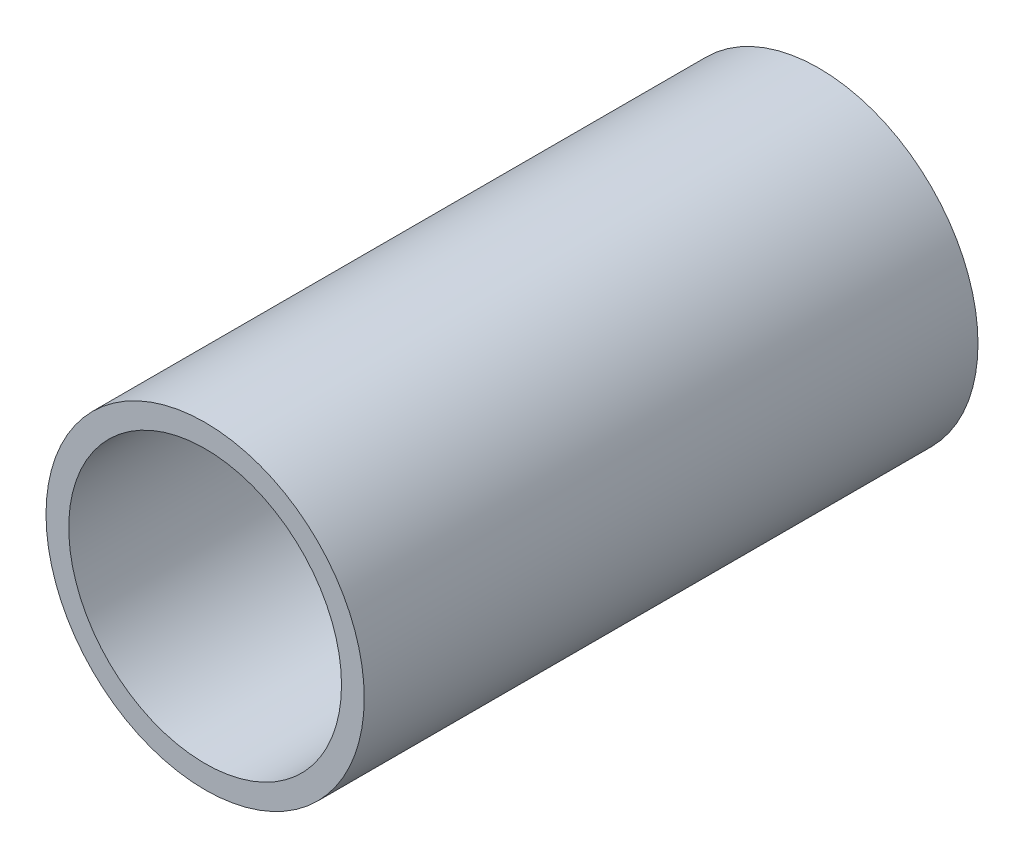
from build123d import *

# Parameters (mm, degrees)
SKETCH1_R           = 22.225
SKETCH1_R_2         = 19.05
BOSS_EXTRUDE1_DEPTH = 85.725


with BuildPart() as part:
    # Sketch1 → Boss-Extrude1 (new body)
    with BuildSketch(Plane.XY):
        Circle(SKETCH1_R)
        Circle(SKETCH1_R_2, mode=Mode.SUBTRACT)
    extrude(amount=BOSS_EXTRUDE1_DEPTH)


solid = part.part
